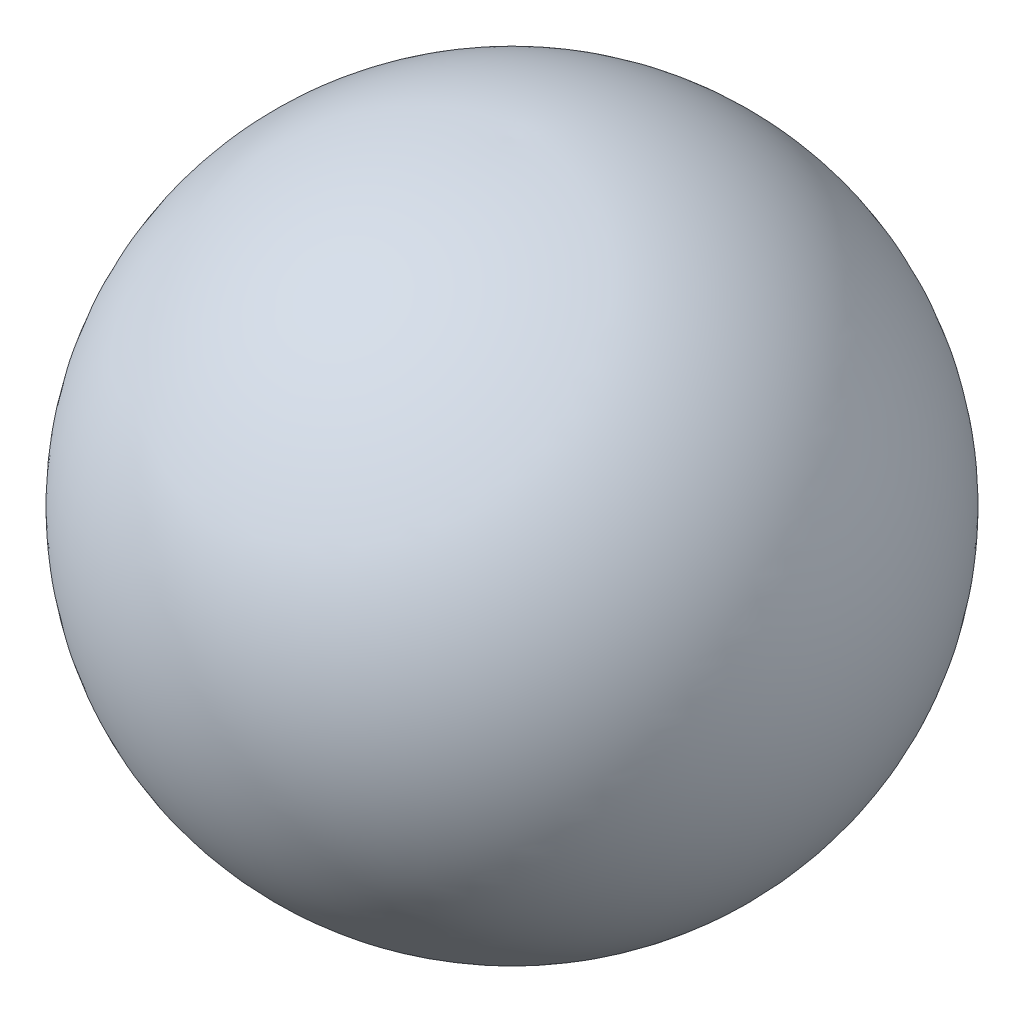
from build123d import *


with BuildPart() as part:
    # Sketch1 → Revolve1 (revolve)
    with BuildSketch(Plane.XY):
        with BuildLine():
            Line((0, 4.7625), (0, -4.7625))
            ThreePointArc((0, -4.7625), (4.916174072, 0), (0, 4.7625))
        make_face()
    revolve(axis=Axis((0, 4.7625, 0), (0, -1, 0)))


solid = part.part
